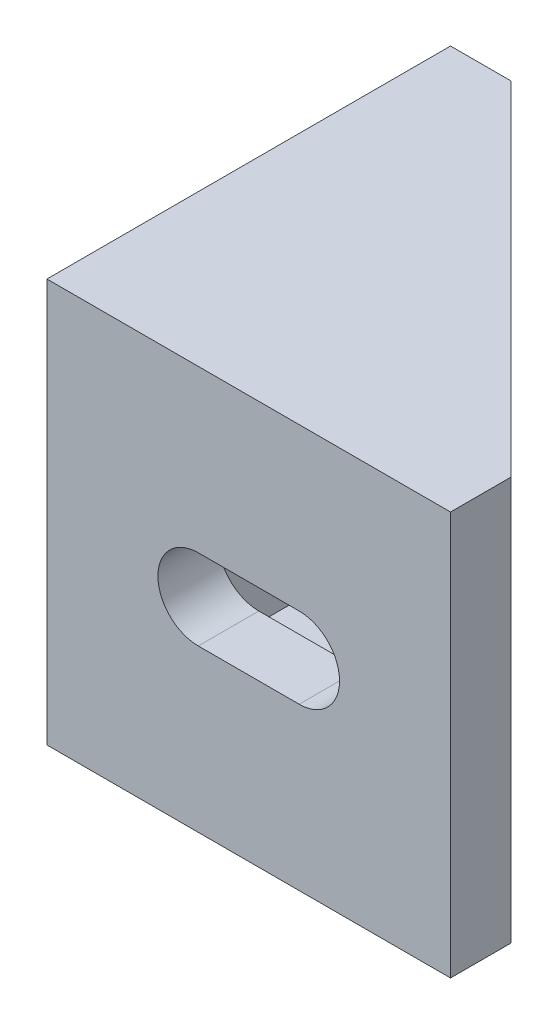
from build123d import *

# Parameters (mm, degrees)
EXTRUDE_2_DEPTH     = 20
EXTRUDE_1_DEPTH     = 3
EXTRUDE_2_2_DEPTH   = 3
CUT_EXTRUDE_1_DEPTH = 34
CUT_EXTRUDE_2_DEPTH = 34


with BuildPart() as part:
    # 草图1 → Extrude 2 (new body)
    with BuildSketch(Plane(origin=(0, 0, 0), x_dir=(1, 0, 0), z_dir=(0, 1, 0))):
        Polygon((0, 20), (0, 0), (20, 0), (20, 3), (3, 3), (3, 20), align=None)
    extrude(amount=EXTRUDE_2_DEPTH)

    # 草图2 → 凸台-拉伸1 (add)
    with BuildSketch(Plane(origin=(0, 20, 0), x_dir=(1, 0, 0), z_dir=(0, 1, 0))):
        Polygon((3, 20), (20, 3), (20, 0), (0, 0), (0, 20), align=None)
    extrude(amount=-EXTRUDE_1_DEPTH)

    # 草图3 → Extrude 2 2 (add)
    with BuildSketch(Plane.XZ):
        Polygon((20, -3), (3, -20), (3, -3), align=None)
    extrude(amount=-EXTRUDE_2_2_DEPTH)

    # 草图5 → 切除-拉伸1 (cut, through all)
    with BuildSketch(Plane(origin=(0, 0, -3), x_dir=(-1, 0, 0), z_dir=(0, 0, -1))):
        with BuildLine():
            Line((-7.5, 8), (-12.5, 8))
            ThreePointArc((-12.5, 8), (-14.5, 10), (-12.5, 12))
            Line((-12.5, 12), (-7.5, 12))
            ThreePointArc((-7.5, 12), (-5.5, 10), (-7.5, 8))
        make_face()
    extrude(amount=-CUT_EXTRUDE_1_DEPTH, mode=Mode.SUBTRACT)

    # 草图6 → 切除-拉伸2 (cut, through all)
    with BuildSketch(Plane(origin=(3, 0, 0), x_dir=(0, 0, -1), z_dir=(1, 0, 0))):
        with BuildLine():
            Line((7.5, 12), (12.5, 12))
            ThreePointArc((12.5, 12), (14.5, 10), (12.5, 8))
            Line((12.5, 8), (7.5, 8))
            ThreePointArc((7.5, 8), (5.5, 10), (7.5, 12))
        make_face()
    extrude(amount=-CUT_EXTRUDE_2_DEPTH, mode=Mode.SUBTRACT)


solid = part.part
